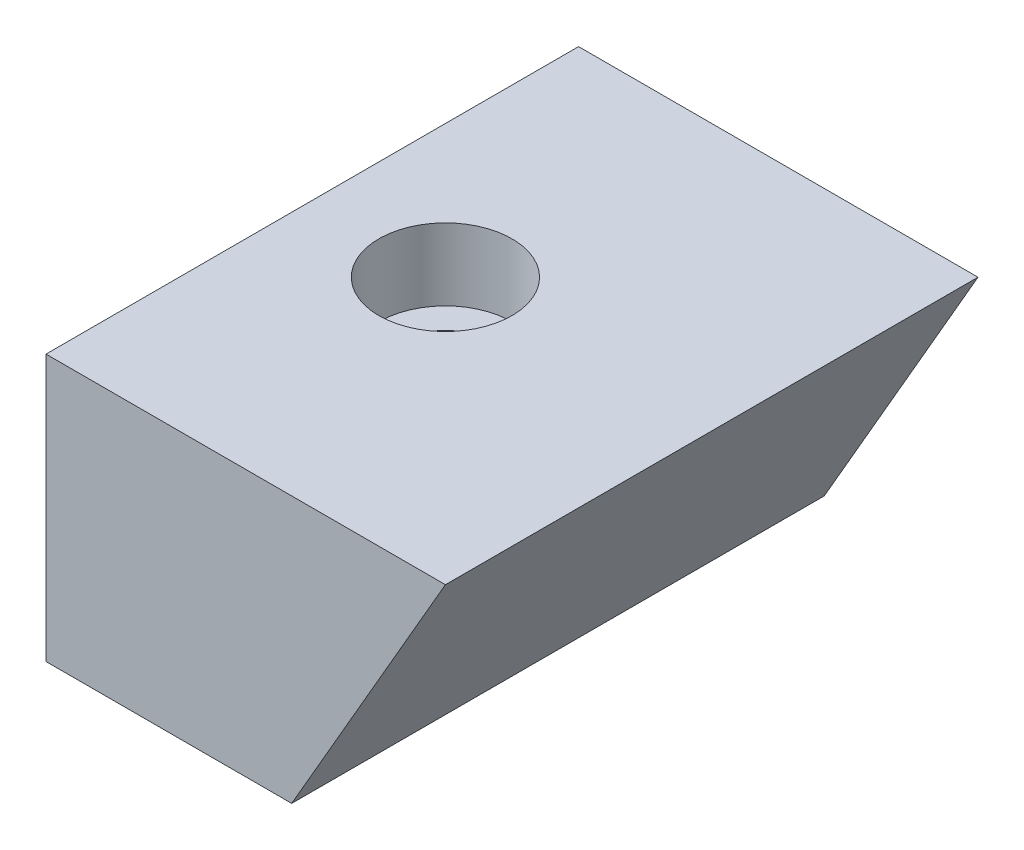
from build123d import *

# Parameters (mm, degrees)
BOSS_EXTRU_1_DEPTH                                 = 40
CHAMBRAGE_POUR_VIS_T_TE_HEXAGONALE_M51_D           = 5.5
CHAMBRAGE_POUR_VIS_T_TE_HEXAGONALE_M51_CBORE_D     = 10
CHAMBRAGE_POUR_VIS_T_TE_HEXAGONALE_M51_CBORE_DEPTH = 5.4


with BuildPart() as part:
    # Esquisse1 → Boss.-Extru.1 (new body)
    with BuildSketch(Plane.XY):
        Polygon((-10, 0.691167323), (8.452994616, 0.691167323), (20, 20.691167323), (-10, 20.691167323), align=None)
    extrude(amount=BOSS_EXTRU_1_DEPTH)

    # Chambrage pour vis à tête hexagonale M51 (through all)
    with Locations(Plane(origin=(0, 20.691167323, 0), x_dir=(1, 0, 0), z_dir=(0, 1, 0))):
        with Locations((0, -20)):
            CounterBoreHole(CHAMBRAGE_POUR_VIS_T_TE_HEXAGONALE_M51_D / 2, CHAMBRAGE_POUR_VIS_T_TE_HEXAGONALE_M51_CBORE_D / 2, CHAMBRAGE_POUR_VIS_T_TE_HEXAGONALE_M51_CBORE_DEPTH)


solid = part.part
